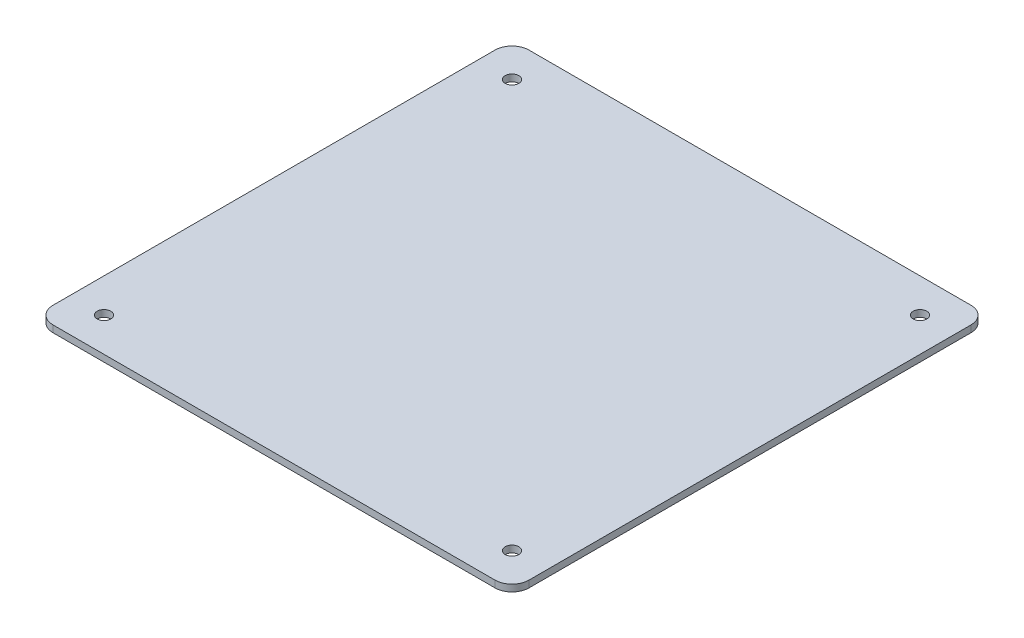
from build123d import *

# Parameters (mm, degrees)
DODANIE_WYCI_GNI_CIE1_DEPTH = 4
SZKIC2_R                    = 4
WYTNIJ_WYCI_GNI_CIE1_DEPTH  = 199.030300712


with BuildPart() as part:
    # Szkic1 → Dodanie-wyciągnięcie1 (new body)
    with BuildSketch(Plane(origin=(0, 0, 0), x_dir=(1, 0, 0), z_dir=(0, 1, 0))):
        with BuildLine():
            Line((-130, -140), (130, -140))
            ThreePointArc((130, -140), (137.071067812, -137.071067812), (140, -130))
            Line((140, -130), (140, 130))
            ThreePointArc((140, 130), (137.071067812, 137.071067812), (130, 140))
            Line((130, 140), (-130, 140))
            ThreePointArc((-130, 140), (-137.071067812, 137.071067812), (-140, 130))
            Line((-140, 130), (-140, -130))
            ThreePointArc((-140, -130), (-137.071067812, -137.071067812), (-130, -140))
        make_face()
    extrude(amount=DODANIE_WYCI_GNI_CIE1_DEPTH)

    # Szkic2 → Wytnij-wyciągnięcie1 (cut, through all)
    with BuildSketch(Plane(origin=(0, 4, 0), x_dir=(1, 0, 0), z_dir=(0, 1, 0))):
        with Locations(Location((120, 120, 0), (0, 0, 270))):
            Circle(SZKIC2_R)
        with Locations(Location((120, -120, 0), (0, 0, 270))):
            Circle(SZKIC2_R)
        with Locations(Location((-120, -120, 0), (0, 0, 270))):
            Circle(SZKIC2_R)
        with Locations(Location((-120, 120, 0), (0, 0, 270))):
            Circle(SZKIC2_R)
    extrude(amount=-WYTNIJ_WYCI_GNI_CIE1_DEPTH, mode=Mode.SUBTRACT)


solid = part.part
